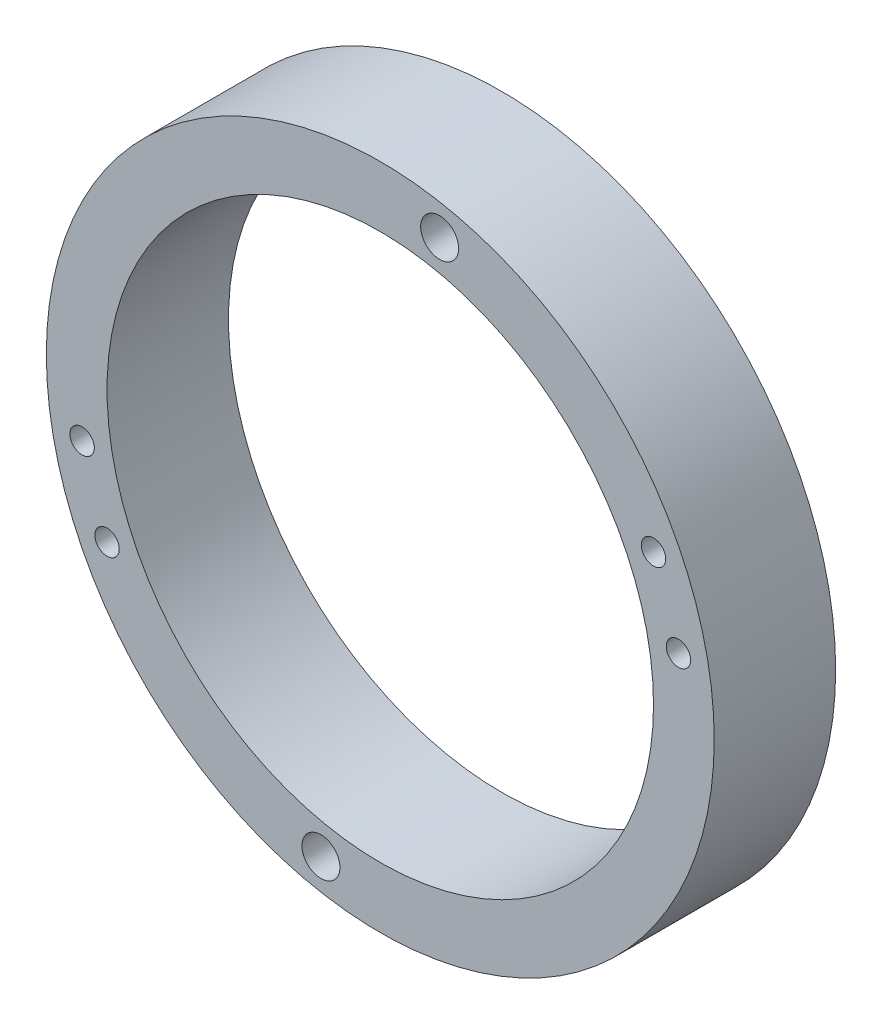
from build123d import *

# Parameters (mm, degrees)
BOSS_EXTRUDE1_DEPTH            = 12.7
BOSS_EXTRUDE1_DEPTH_BACK       = 12.7
SKETCH3_R                      = 69.85
SKETCH3_R_2                    = 57.15
TAP_DRILL_FOR_1_4_20_TAP1_D    = 5.1054
F_5_16_0_3125_DIAMETER_HOLE1_D = 7.9375
CIRPATTERN1_COUNT              = 2


with BuildPart() as part:
    # Sketch3 → Boss-Extrude1 (new, two sides: drawn at the far end of the back side and taken through both)
    with BuildSketch(Plane.XY.offset(-BOSS_EXTRUDE1_DEPTH_BACK)):
        Circle(SKETCH3_R)
        Circle(SKETCH3_R_2, mode=Mode.SUBTRACT)
    extrude(amount=BOSS_EXTRUDE1_DEPTH + BOSS_EXTRUDE1_DEPTH_BACK)

    # Tap Drill for 1/4-20 Tap1 (through all)
    with Locations(Plane.XY.offset(12.7)):
        with Locations((-57.15, -27.679008291), (-62.366515468, -11.944360527)):
            tap_drill_for_1_4_20_tap1 = Hole(TAP_DRILL_FOR_1_4_20_TAP1_D / 2)

    # 5/16 (0.3125) Diameter Hole1 (through all)
    with Locations(Plane.XY.offset(12.7)):
        with Locations((-12.413435939, -62.274847316)):
            f_5_16_0_3125_diameter_hole1 = Hole(F_5_16_0_3125_DIAMETER_HOLE1_D / 2)

    # CirPattern1: Tap Drill for 1/4-20 Tap1, 5/16 (0.3125) Diameter Hole1 ×2 about axis
    cirpattern1_axis = Axis((0, 0, 0), (0, 0, 1))
    add([tap_drill_for_1_4_20_tap1.rotate(cirpattern1_axis, i * 360 / CIRPATTERN1_COUNT) for i in range(1, CIRPATTERN1_COUNT)], mode=Mode.SUBTRACT)
    add([f_5_16_0_3125_diameter_hole1.rotate(cirpattern1_axis, i * 360 / CIRPATTERN1_COUNT) for i in range(1, CIRPATTERN1_COUNT)], mode=Mode.SUBTRACT)


solid = part.part
